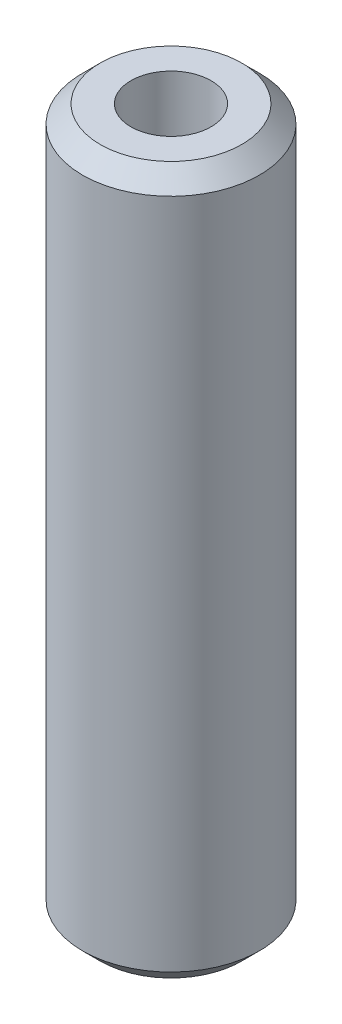
from build123d import *

# Parameters (mm, degrees)
SKETCH1_R                   = 12.7
BOSS_EXTRUDE1_DEPTH         = 101.6
F_1_2_20_TAPPED_HOLE1_D     = 11.50874
F_1_2_20_TAPPED_HOLE1_DEPTH = 38.1
F_1_2_20_TAPPED_HOLE1_TIP   = 3.45757432
F_1_2_20_TAPPED_HOLE2_D     = 11.50874
F_1_2_20_TAPPED_HOLE2_DEPTH = 38.1
F_1_2_20_TAPPED_HOLE2_TIP   = 3.45757432
CHAMFER1_SIZE               = 2.54


with BuildPart() as part:
    # Sketch1 → Boss-Extrude1 (new body)
    with BuildSketch(Plane(origin=(0, 0, 0), x_dir=(1, 0, 0), z_dir=(0, 1, 0))):
        with Locations(Location((0, 0, 0), (0, 0, 270))):
            Circle(SKETCH1_R)
    extrude(amount=BOSS_EXTRUDE1_DEPTH)

    # 1/2-20 Tapped Hole1
    with Locations(Plane.ZX.offset(101.6)):
        with Locations((0, 0)):
            Hole(F_1_2_20_TAPPED_HOLE1_D / 2, depth=F_1_2_20_TAPPED_HOLE1_DEPTH)
            with Locations((0, 0, -(F_1_2_20_TAPPED_HOLE1_DEPTH + F_1_2_20_TAPPED_HOLE1_TIP / 2))):  # 118° drill point
                Cone(0, F_1_2_20_TAPPED_HOLE1_D / 2, F_1_2_20_TAPPED_HOLE1_TIP, mode=Mode.SUBTRACT)

    # 1/2-20 Tapped Hole2
    with Locations(Plane(origin=(0, 0, 0), x_dir=(0, 0, -1), z_dir=(0, -1, 0))):
        with Locations((0, 0)):
            Hole(F_1_2_20_TAPPED_HOLE2_D / 2, depth=F_1_2_20_TAPPED_HOLE2_DEPTH)
            with Locations((0, 0, -(F_1_2_20_TAPPED_HOLE2_DEPTH + F_1_2_20_TAPPED_HOLE2_TIP / 2))):  # 118° drill point
                Cone(0, F_1_2_20_TAPPED_HOLE2_D / 2, F_1_2_20_TAPPED_HOLE2_TIP, mode=Mode.SUBTRACT)

    # Chamfer1
    chamfer1_edges = [part.edges().sort_by_distance(p)[0] for p in [
        (0, 0, -12.7),
        (0, 101.6, -12.7),
    ]]
    chamfer(chamfer1_edges, length=CHAMFER1_SIZE)


solid = part.part
